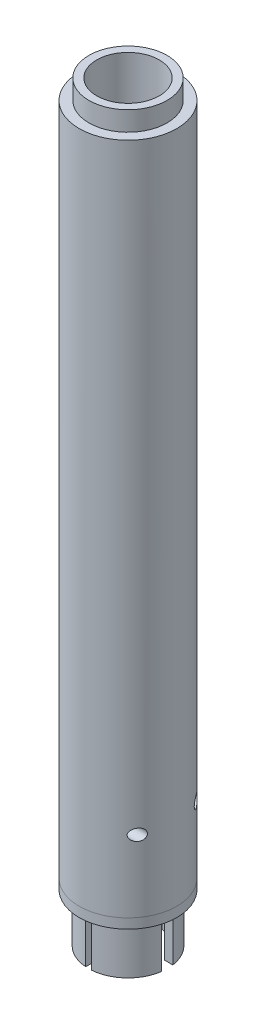
from build123d import *

# Parameters (mm, degrees)
SKETCH1_R               = 12.7
BOSS_EXTRUDE1_DEPTH     = 177.8
SKETCH4_R               = 10.16
BOSS_EXTRUDE2_DEPTH     = 5.08
SKETCH5_R               = 8.128
CUT_EXTRUDE1_DEPTH      = 184.759828036
SKETCH6_R               = 10.287
SKETCH6_R_2             = 8.128
BOSS_EXTRUDE3_DEPTH     = 12.7
CUT_EXTRUDE2_DEPTH      = 0.762
CUT_EXTRUDE2_DEPTH_BACK = 0.762
SKETCH10_W              = 20.828
SKETCH10_H              = 59.309
SKETCH10_R              = 1.5
CUT_EXTRUDE3_DEPTH      = 184.759828136
CUT_EXTRUDE3_DEPTH_BACK = 184.759828136
SKETCH11_R              = 1.5
CUT_EXTRUDE4_DEPTH      = 197.402944082
CUT_EXTRUDE4_DEPTH_BACK = 12.7
SKETCH12_W              = 50.8
SKETCH12_H              = 3


with BuildPart() as part:
    # Sketch1 → Boss-Extrude1 (new body)
    with BuildSketch(Plane(origin=(0, 0, 0), x_dir=(1, 0, 0), z_dir=(0, 1, 0))):
        with Locations(Location((0, 0, 0), (0, 0, 270))):
            Circle(SKETCH1_R)
    extrude(amount=BOSS_EXTRUDE1_DEPTH)

    # Sketch4 → Boss-Extrude2 (add)
    with BuildSketch(Plane(origin=(0, 177.8, 0), x_dir=(1, 0, 0), z_dir=(0, 1, 0))):
        with Locations(Location((0, 0, 0), (0, 0, 270))):
            Circle(SKETCH4_R)
    extrude(amount=BOSS_EXTRUDE2_DEPTH)

    # Sketch5 → Cut-Extrude1 (cut, through all)
    with BuildSketch(Plane(origin=(0, 182.88, 0), x_dir=(1, 0, 0), z_dir=(0, 1, 0))):
        with Locations(Location((0, 0, 0), (0, 0, 270))):
            Circle(SKETCH5_R)
    extrude(amount=-CUT_EXTRUDE1_DEPTH, mode=Mode.SUBTRACT)

    # Sketch6 → Boss-Extrude3 (add)
    with BuildSketch(Plane.XZ):
        with Locations(Location((0, 0, 0), (0, 0, 90))):
            Circle(SKETCH6_R)
        with Locations(Location((0, 0, 0), (0, 0, 90))):
            Circle(SKETCH6_R_2, mode=Mode.SUBTRACT)
    extrude(amount=BOSS_EXTRUDE3_DEPTH)


with BuildPart() as body_2:
    # Split1: the piece on the far side of the plane
    add(part.part)
    split(bisect_by=Plane(origin=(0, 2.54, 0), x_dir=(0, 0, -1), z_dir=(0, -1, 0)), keep=Keep.BOTTOM)


with BuildPart() as part_1:
    add(part.part)

    # Split1
    split(bisect_by=Plane(origin=(0, 2.54, 0), x_dir=(0, 0, -1), z_dir=(0, -1, 0)), keep=Keep.TOP)


with BuildPart() as cut_extrude2_tool:
    # Sketch10 → Cut-Extrude2 (new, two sides: drawn at the far end of the back side and taken through both)
    with BuildSketch(Plane(origin=(0, 0, 0), x_dir=(0, 0, -1), z_dir=(1, 0, 0)).offset(-CUT_EXTRUDE2_DEPTH_BACK)):
        with Locations((0, -5.9055)):
            Rectangle(SKETCH10_W, SKETCH10_H)
        with Locations((7.5946, 21.1836)):
            Circle(SKETCH10_R, mode=Mode.SUBTRACT)
        with Locations((-7.5946, 21.1836)):
            Circle(SKETCH10_R, mode=Mode.SUBTRACT)
    extrude(amount=CUT_EXTRUDE2_DEPTH + CUT_EXTRUDE2_DEPTH_BACK)


with BuildPart() as part_2:
    add(part_1.part)

    # Cut-Extrude2: cut by cut_extrude2_tool
    add(cut_extrude2_tool.part, mode=Mode.SUBTRACT)

    # Sketch12 → Cut-Extrude4 (cut, two sides: drawn at the far end of the back side and taken through both)
    with BuildSketch(Plane.XZ.offset(12.7).offset(-CUT_EXTRUDE4_DEPTH_BACK)):
        Rectangle(SKETCH12_W, SKETCH12_H)
    extrude(amount=CUT_EXTRUDE4_DEPTH + CUT_EXTRUDE4_DEPTH_BACK, mode=Mode.SUBTRACT)


with BuildPart() as body_2_1:
    add(body_2.part)

    # Cut-Extrude2: cut by cut_extrude2_tool
    add(cut_extrude2_tool.part, mode=Mode.SUBTRACT)

    # Sketch11 → Cut-Extrude3 (cut, two sides: drawn at the far end of the back side and taken through both)
    with BuildSketch(Plane(origin=(0, 0, 0), x_dir=(0, 0, -1), z_dir=(1, 0, 0)).offset(-CUT_EXTRUDE3_DEPTH_BACK)):
        with Locations((7.5946, 21.1836)):
            Circle(SKETCH11_R)
        with Locations((-7.5946, 21.1836)):
            Circle(SKETCH11_R)
    extrude(amount=CUT_EXTRUDE3_DEPTH + CUT_EXTRUDE3_DEPTH_BACK, mode=Mode.SUBTRACT)


solid = Compound([part_2.part, body_2_1.part])
